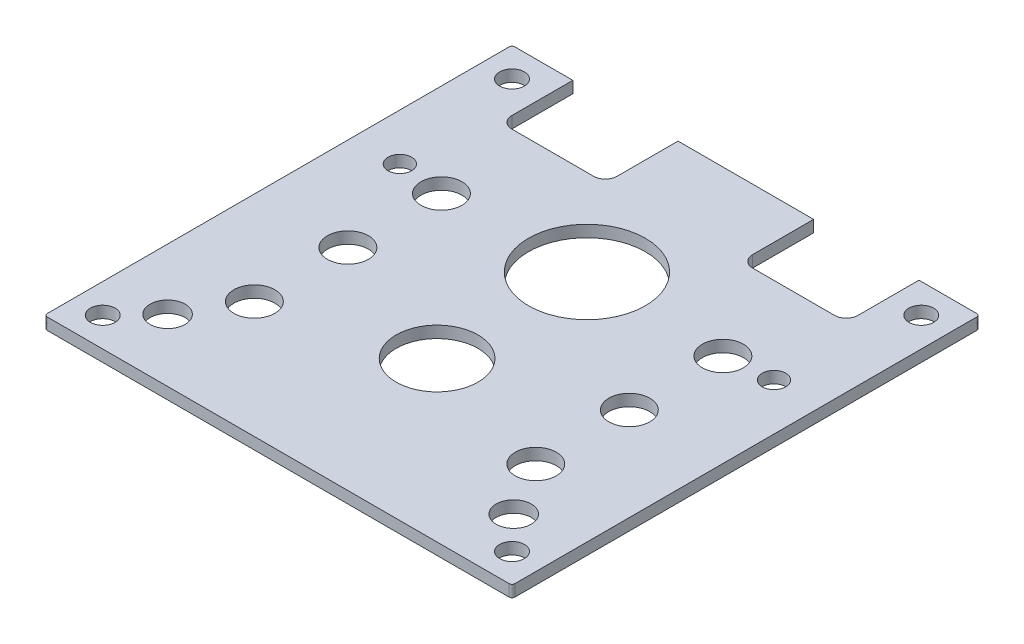
from build123d import *

# Parameters (mm, degrees)
SKETCH1_W                    = 127
SKETCH1_H                    = 127
BOSS_EXTRUDE1_DEPTH          = 3.175
M20_CLEARANCE_HOLE1_D        = 22.225
M6_CLEARANCE_HOLE1_D         = 6.7056
HOLE1_D                      = 31.75
M10_CLEARANCE_HOLE1_D        = 11.1252
FILLET1_R                    = 0.79375
M6_CLEARANCE_HOLE2_D         = 6.4
CUT_EXTRUDE1_DEPTH           = 110.992087544
F_3_8_0_375_DIAMETER_HOLE1_D = 9.525


with BuildPart() as part:
    # Sketch1 → Boss-Extrude1 (new body)
    with BuildSketch(Plane(origin=(0, 0, 0), x_dir=(1, 0, 0), z_dir=(0, 1, 0))):
        with Locations((13.673098237, 14.8102267)):
            Rectangle(SKETCH1_W, SKETCH1_H)
    extrude(amount=-BOSS_EXTRUDE1_DEPTH)

    # M20 Clearance Hole1 (through all)
    with Locations(Plane.XZ.offset(3.175)):
        with Locations((13.673098237, 5.5351733)):
            Hole(M20_CLEARANCE_HOLE1_D / 2)

    # M6 Clearance Hole1 (through all)
    with Locations(Plane.XZ.offset(3.175)):
        with Locations((-41.889401763, -70.3727267), (69.235598237, 40.7522733), (69.235598237, -70.3727267), (-41.889401763, 40.7522733)):
            Hole(M6_CLEARANCE_HOLE1_D / 2)

    # Hole1 (through all)
    with Locations(Plane.XZ.offset(3.175)):
        with Locations((13.673098237, -35.1556267)):
            Hole(HOLE1_D / 2)

    # M10 Clearance Hole1 (through all)
    with Locations(Plane.XZ.offset(3.175)):
        with Locations((-24.535146731, -33.8602267), (51.881343204, 16.9397733), (-24.535146731, -8.4602267), (-24.535146731, 16.9397733), (51.881343204, -33.8602267), (51.881343204, -8.4602267)):
            Hole(M10_CLEARANCE_HOLE1_D / 2)

    # Fillet1
    fillet1_edges = [part.edges().sort_by_distance(p)[0] for p in [
        (77.173098237, -1.5875, -78.3102267),
        (77.173098237, -1.5875, 48.6897733),
        (-49.826901763, -1.5875, 48.6897733),
        (-49.826901763, -1.5875, -78.3102267),
    ]]
    fillet(fillet1_edges, radius=FILLET1_R)

    # M6 Clearance Hole2 (through all)
    with Locations(Plane(origin=(0, 0, 0), x_dir=(-1, 0, 0), z_dir=(0, 1, 0))):
        with Locations((-64.473098237, -35.1556267), (37.126901763, -35.1556267)):
            Hole(M6_CLEARANCE_HOLE2_D / 2)

    # Sketch12 → Cut-Extrude1 (cut, through all)
    with BuildSketch(Plane.XZ.offset(3.175)):
        with BuildLine():
            Line((-33.316901763, -78.3102267), (-33.316901763, -61.7462517))
            ThreePointArc((-33.316901763, -61.7462517), (-32.386965793, -59.50118767), (-30.141901763, -58.5712517))
            Line((-30.141901763, -58.5712517), (-7.916901763, -58.5712517))
            ThreePointArc((-7.916901763, -58.5712517), (-5.671837733, -59.50118767), (-4.741901763, -61.7462517))
            Line((-4.741901763, -61.7462517), (-4.741901763, -78.3102267))
            Line((-4.741901763, -78.3102267), (-33.316901763, -78.3102267))
        make_face()
        with BuildLine():
            Line((32.075398237, -78.3102267), (32.075398237, -61.7462517))
            ThreePointArc((32.075398237, -61.7462517), (33.005334207, -59.50118767), (35.250398237, -58.5712517))
            Line((35.250398237, -58.5712517), (57.500798237, -58.5712517))
            ThreePointArc((57.500798237, -58.5712517), (59.745862267, -59.50118767), (60.675798237, -61.7462517))
            Line((60.675798237, -61.7462517), (60.675798237, -78.3102267))
            Line((60.675798237, -78.3102267), (32.075398237, -78.3102267))
        make_face()
    extrude(amount=-CUT_EXTRUDE1_DEPTH, mode=Mode.SUBTRACT)

    # 3/8 (0.375) Diameter Hole1 (through all)
    with Locations(Plane.XZ.offset(3.175)):
        with Locations((60.663098237, 31.717491348), (-33.316901763, 31.717491348)):
            Hole(F_3_8_0_375_DIAMETER_HOLE1_D / 2)


solid = part.part
